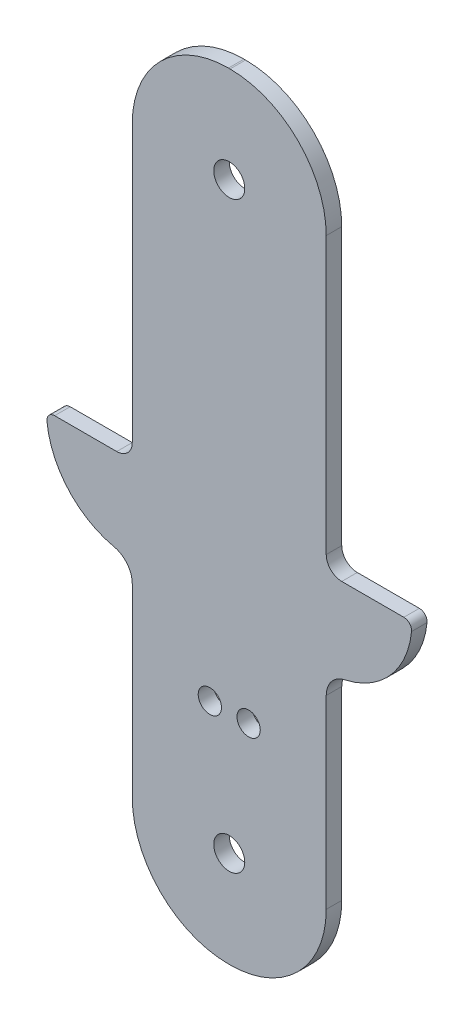
from build123d import *

# Parameters (mm, degrees)
SKETCH1_R           = 2
SKETCH1_R_2         = 1.5
BOSS_EXTRUDE1_DEPTH = 2


with BuildPart() as part:
    # Sketch1 → Boss-Extrude1 (new body)
    with BuildSketch(Plane.XY):
        with BuildLine():
            Line((12.4, 0), (12.6, 0))
            ThreePointArc((12.6, 0), (21.368124087, 3.631875913), (25, 12.4))
            Line((25, 12.4), (25, 36.274148297))
            ThreePointArc((25, 36.274148297), (25.663151139, 38.155407822), (27.359424934, 39.204961083))
            ThreePointArc((27.359424934, 39.204961083), (33.251440199, 42.65061323), (35.99503719, 48.900496281))
            ThreePointArc((35.99503719, 48.900496281), (35.741452534, 49.671005321), (35, 50))
            Line((35, 50), (27, 50))
            ThreePointArc((27, 50), (25.585786438, 50.585786438), (25, 52))
            Line((25, 52), (25, 87.6))
            ThreePointArc((25, 87.6), (21.368124087, 96.368124087), (12.6, 100))
            Line((12.6, 100), (12.4, 100))
            ThreePointArc((12.4, 100), (3.631875913, 96.368124087), (0, 87.6))
            Line((0, 87.6), (0, 52))
            ThreePointArc((0, 52), (-0.585786438, 50.585786438), (-2, 50))
            Line((-2, 50), (-10, 50))
            ThreePointArc((-10, 50), (-10.741452534, 49.671005321), (-10.99503719, 48.900496281))
            ThreePointArc((-10.99503719, 48.900496281), (-8.251440199, 42.65061323), (-2.359424934, 39.204961083))
            ThreePointArc((-2.359424934, 39.204961083), (-0.663151139, 38.155407822), (0, 36.274148297))
            Line((0, 36.274148297), (0, 12.4))
            ThreePointArc((0, 12.4), (3.631875913, 3.631875913), (12.4, 0))
        make_face()
        with Locations((12.5, 87.6)):
            Circle(SKETCH1_R, mode=Mode.SUBTRACT)
        with Locations((12.5, 12.4)):
            Circle(SKETCH1_R, mode=Mode.SUBTRACT)
        with Locations((10, 28.153438796)):
            Circle(SKETCH1_R_2, mode=Mode.SUBTRACT)
        with Locations((15, 28.153438796)):
            Circle(SKETCH1_R_2, mode=Mode.SUBTRACT)
    extrude(amount=BOSS_EXTRUDE1_DEPTH)


solid = part.part
